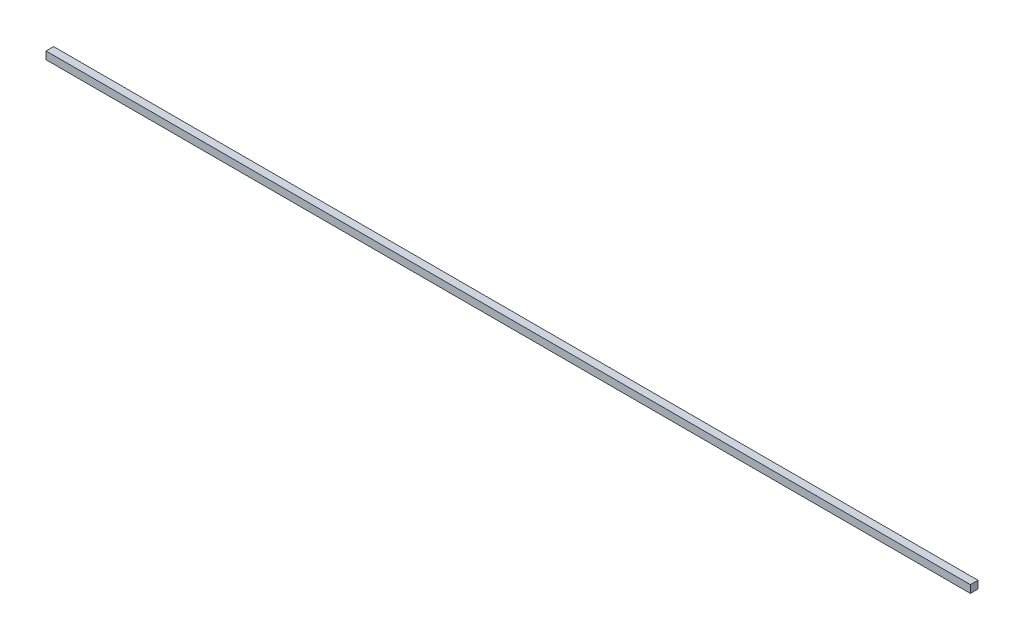
from build123d import *

# Parameters (mm, degrees)
SKETCH1_W           = 243
SKETCH1_H           = 2
BOSS_EXTRUDE1_DEPTH = 2


with BuildPart() as part:
    # Sketch1 → Boss-Extrude1 (new body)
    with BuildSketch(Plane(origin=(0, 0, 0), x_dir=(1, 0, 0), z_dir=(0, 1, 0))):
        Rectangle(SKETCH1_W, SKETCH1_H)
    extrude(amount=BOSS_EXTRUDE1_DEPTH)


solid = part.part
